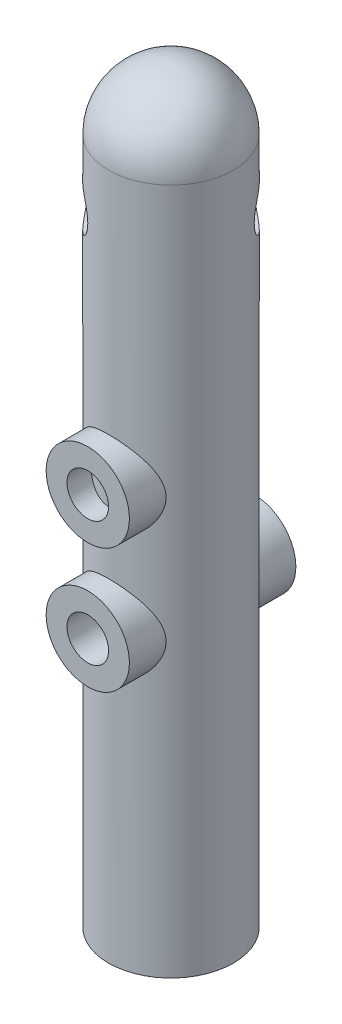
from build123d import *

# Parameters (mm, degrees)
SKETCH1_R               = 1.5
BOSS_EXTRUDE1_DEPTH     = 18
FILLET1_R               = 1.5
SKETCH2_R               = 1
SKETCH2_R_2             = 0.5
EXTRUDE_THIN1_DEPTH     = 2
EXTRUDE_THIN2_START     = -2
SKETCH2_2_R             = 1
SKETCH2_2_R_2           = 0.5
EXTRUDE_THIN2_DEPTH     = 2
CUT_EXTRUDE1_DEPTH      = 19.172781865
CUT_EXTRUDE1_DEPTH_BACK = 19.172781865
SKETCH3_R               = 0.5
SKETCH4_R               = 0.5
CUT_EXTRUDE2_DEPTH      = 3
SKETCH5_R               = 0.75
CUT_EXTRUDE3_DEPTH      = 17


with BuildPart() as part:
    # Sketch1 → Boss-Extrude1 (new body)
    with BuildSketch(Plane(origin=(0, 0, 0), x_dir=(1, 0, 0), z_dir=(0, 1, 0))):
        Circle(SKETCH1_R)
    extrude(amount=BOSS_EXTRUDE1_DEPTH)

    # Fillet1
    fillet1_edges = [part.edges().sort_by_distance(p)[0] for p in [
        (-1.5, 18, 0),
    ]]
    fillet(fillet1_edges, radius=FILLET1_R)

    # Sketch2 → Extrude-Thin1 (add)
    # profile 1 of 2: a face of its own
    with BuildSketch(Plane.XY):
        with Locations((0, 7)):
            Circle(SKETCH2_R)
        with Locations((0, 7)):
            Circle(SKETCH2_R_2, mode=Mode.SUBTRACT)
    # profile 2 of 2: a face of its own
    with BuildSketch(Plane.XY):
        with Locations((0, 10)):
            Circle(SKETCH2_R)
        with Locations((0, 10)):
            Circle(SKETCH2_R_2, mode=Mode.SUBTRACT)
    extrude(amount=EXTRUDE_THIN1_DEPTH)

    # Sketch2<2> → Extrude-Thin2 (add)
    with BuildSketch(Plane.XY.offset(EXTRUDE_THIN2_START)):
        with Locations((0, 7)):
            Circle(SKETCH2_2_R)
        with Locations((0, 7)):
            Circle(SKETCH2_2_R_2, mode=Mode.SUBTRACT)
    extrude(amount=EXTRUDE_THIN2_DEPTH)

    # Sketch3 → Cut-Extrude1 (cut, two sides: drawn at the far end of the back side and taken through both)
    with BuildSketch(Plane.XY.offset(-CUT_EXTRUDE1_DEPTH_BACK)):
        with Locations((0, 7)):
            Circle(SKETCH3_R)
    extrude(amount=CUT_EXTRUDE1_DEPTH + CUT_EXTRUDE1_DEPTH_BACK, mode=Mode.SUBTRACT)

    # Sketch4 → Cut-Extrude2 (cut, symmetric)
    with BuildSketch(Plane(origin=(0, 0, 0), x_dir=(0.7071067811865477, 0, 0.7071067811865475), z_dir=(-0.7071067811865475, 0, 0.7071067811865477))):
        with Locations((0, 15)):
            Circle(SKETCH4_R)
    extrude(amount=CUT_EXTRUDE2_DEPTH, both=True, mode=Mode.SUBTRACT)

    # Sketch5 → Cut-Extrude3 (cut)
    with BuildSketch(Plane.XZ):
        Circle(SKETCH5_R)
    extrude(amount=-CUT_EXTRUDE3_DEPTH, mode=Mode.SUBTRACT)


solid = part.part
